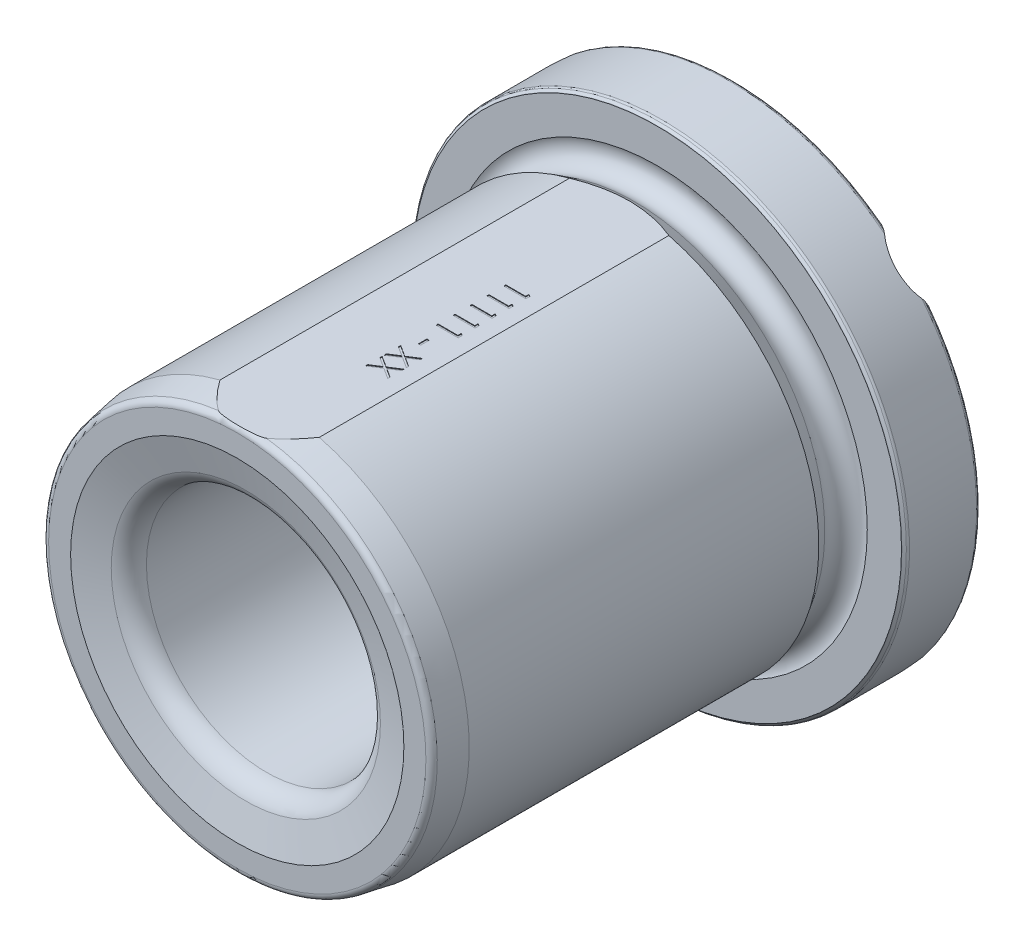
from build123d import *

# Parameters (mm, degrees)
SKETCH2_W          = 23.749496475
SKETCH2_H          = 8.889476334
CUT_EXTRUDE1_DEPTH = 63.5
SKETCH5_W          = 0.358974359
SKETCH5_H          = 1.346153846
PARTNO_DEPTH       = 0.1
SKETCH4_R          = 8
CUT_EXTRUDE2_DEPTH = 66
CIRPATTERN1_COUNT  = 4
SKETCH3_W          = 103.866537798
SKETCH3_H          = 40.861636781


with BuildPart() as part:
    # Sketch1 → Revolve1 (revolve)
    with BuildSketch(Plane(origin=(0, 0, 0), x_dir=(0, 0, -1), z_dir=(1, 0, 0)), mode=Mode.PRIVATE) as revolve1_sk:
        with BuildLine():
            Line((0, 21.548900035), (0, 38.442893219))
            ThreePointArc((0, 38.442893219), (-0.038060234, 38.634234935), (-0.146446609, 38.796446609))
            Line((-0.146446609, 38.796446609), (-0.603553391, 39.253553391))
            ThreePointArc((-0.603553391, 39.253553391), (-0.765765065, 39.361939766), (-0.957106781, 39.4))
            Line((-0.957106781, 39.4), (-11.642893219, 39.4))
            ThreePointArc((-11.642893219, 39.4), (-11.834234935, 39.361939766), (-11.996446609, 39.253553391))
            Line((-11.996446609, 39.253553391), (-12.353553391, 38.896446609))
            ThreePointArc((-12.353553391, 38.896446609), (-12.461939766, 38.734234935), (-12.5, 38.542893219))
            Line((-12.5, 38.542893219), (-12.5, 33.65))
            ThreePointArc((-12.5, 33.65), (-12.895860273, 30.592974987), (-15.958604366, 30.244111259))
            Line((-15.958604366, 30.244111259), (-18.65, 31.8975))
            Line((-18.65, 31.8975), (-73.15, 31.8975))
            Line((-73.15, 31.8975), (-78.323648178, 30.985246238))
            ThreePointArc((-78.323648178, 30.985246238), (-78.916044443, 30.643226094), (-79.15, 30.000438485))
            Line((-79.15, 30.000438485), (-79.15, 26.5))
            Line((-79.15, 26.5), (-79.15, 26.45))
            Line((-79.15, 26.45), (-77.87566937, 21.694133342))
            ThreePointArc((-77.87566937, 21.694133342), (-76.625593979, 19.823263309), (-74.494928978, 19.1))
            Line((-74.494928978, 19.1), (-4.125860531, 19.1))
            ThreePointArc((-4.125860531, 19.1), (-4.003807467, 19.115125738), (-3.889138974, 19.159587801))
            Line((-3.889138974, 19.159587801), (-0.263278443, 21.108487837))
            ThreePointArc((-0.263278443, 21.108487837), (-0.070837573, 21.292346706), (0, 21.548900035))
        make_face()
    revolve(revolve1_sk.sketch.rotate(Axis((0, 0, 0), (0, 0, 1)), 90), axis=Axis((0, 0, 0), (0, 0, 1)))

    # Sketch2 → Cut-Extrude1 (cut)
    with BuildSketch(Plane.XY.offset(79.15)):
        with Locations((0.59705438, 35.194738167)):
            Rectangle(SKETCH2_W, SKETCH2_H)
    cut_extrude1 = extrude(amount=-CUT_EXTRUDE1_DEPTH, mode=Mode.SUBTRACT)

    # Mirror1: Cut-Extrude1 across plane
    add(cut_extrude1.mirror(Plane.ZX), mode=Mode.SUBTRACT)

    # Sketch5 → PARTNO (cut)
    with BuildSketch(Plane(origin=(0, 30.75, 0), x_dir=(1, 0, 0), z_dir=(0, 1, 0))):
        Polygon((5.235774342, -37.836425742), (5.235774342, -38.483561158), (1.735774342, -38.483561158), (1.735774342, -38.169458594), (4.876799983, -38.169458594), (4.876799983, -37.630997056), align=None)
        Polygon((5.235774342, -40.528733434), (5.235774342, -41.175868851), (1.735774342, -41.175868851), (1.735774342, -40.861766287), (4.876799983, -40.861766287), (4.876799983, -40.323304748), align=None)
        Polygon((5.235774342, -43.221041126), (5.235774342, -43.868176543), (1.735774342, -43.868176543), (1.735774342, -43.554073979), (4.876799983, -43.554073979), (4.876799983, -43.01561244), align=None)
        Polygon((5.235774342, -45.913348819), (5.235774342, -46.560484235), (1.735774342, -46.560484235), (1.735774342, -46.246381671), (4.876799983, -46.246381671), (4.876799983, -45.707920133), align=None)
        Polygon((5.235774342, -48.605656511), (5.235774342, -49.252791928), (1.735774342, -49.252791928), (1.735774342, -48.938689363), (4.876799983, -48.938689363), (4.876799983, -48.400227825), align=None)
        with Locations((3.081928189, -52.573304748)):
            Rectangle(SKETCH5_W, SKETCH5_H)
        Polygon((5.235774342, -54.929073979), (5.235774342, -55.291553947), (3.804784759, -56.207219011), (5.235774342, -57.122182953), (5.235774342, -57.486766287), (3.520830432, -56.389510678), (1.735774342, -57.531638081), (1.735774342, -57.169158113), (3.237577227, -56.207920133), (1.735774342, -55.247383274), (1.735774342, -54.884202184), (3.521531554, -56.026329588), align=None)
        Polygon((5.235774342, -57.89061244), (5.235774342, -58.253092408), (3.804784759, -59.168757472), (5.235774342, -60.083721415), (5.235774342, -60.448304748), (3.520830432, -59.351049139), (1.735774342, -60.493176543), (1.735774342, -60.130696575), (3.237577227, -59.169458594), (1.735774342, -58.208921735), (1.735774342, -57.845740645), (3.521531554, -58.987868049), align=None)
    extrude(amount=-PARTNO_DEPTH, mode=Mode.SUBTRACT)

    # Sketch4 → Cut-Extrude2 (cut)
    with BuildSketch(Plane(origin=(0, 0, 0), x_dir=(0, 0, -1), z_dir=(0.7071067811865488, 0.7071067811865462, 0))):
        with Locations((5.85, 0)):
            Circle(SKETCH4_R)
    cut_extrude2 = extrude(amount=-CUT_EXTRUDE2_DEPTH, mode=Mode.SUBTRACT)

    # CirPattern1: Cut-Extrude2 ×4 about axis
    cirpattern1_axis = Axis((0, 0, 18.65), (0, 0, 1))
    for i in range(1, CIRPATTERN1_COUNT):
        add(cut_extrude2.rotate(cirpattern1_axis, i * 360 / CIRPATTERN1_COUNT), mode=Mode.SUBTRACT)

    # Sketch3 → Cut-Revolve1 (revolve, cut)
    with BuildSketch(Plane(origin=(0, 0, 0), x_dir=(0, 0, -1), z_dir=(1, 0, 0)), mode=Mode.PRIVATE) as cut_revolve1_sk:
        with Locations((-39.166018409, 30.231076287)):
            Rectangle(SKETCH3_W, SKETCH3_H)
        with BuildLine():
            Line((-79.15, 26.5), (-76.750739653, 17.545838484))
            Line((-76.750739653, 17.545838484), (-0.15, 17.545838484))
            Line((-0.15, 17.545838484), (-0.15, 40.923802074))
            Line((-0.15, 40.923802074), (-12.38, 40.923802074))
            Line((-12.38, 40.923802074), (-12.38, 33.2475))
            ThreePointArc((-12.38, 33.2475), (-12.819339828, 32.186839828), (-13.88, 31.7475))
            Line((-13.88, 31.7475), (-79.15, 31.7475))
            Line((-79.15, 31.7475), (-79.15, 26.5))
        make_face(mode=Mode.SUBTRACT)
    revolve(cut_revolve1_sk.sketch.rotate(Axis((0, 0, 0), (0, 0, 1)), 90), axis=Axis((0, 0, 0), (0, 0, 1)), mode=Mode.SUBTRACT)


solid = part.part
